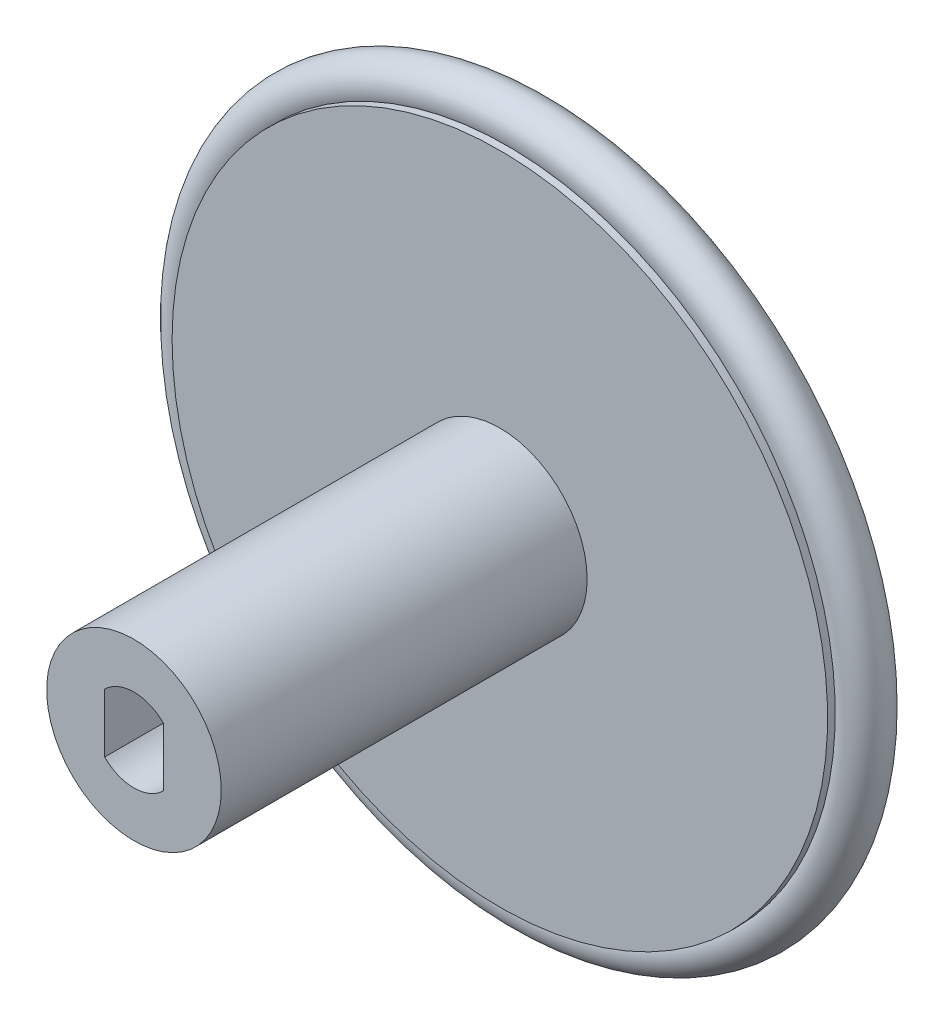
from build123d import *

# Parameters (mm, degrees)
CROQUIS3_R              = 5.725
SALIENTE_EXTRUIR2_DEPTH = 24
SALIENTE_EXTRUIR3_REACH = 48.199
SALIENTE_EXTRUIR3_START = -5
CROQUIS5_R              = 1.5


with BuildPart() as part:
    # Croquis1 → Revolución1 (revolve)
    with BuildSketch(Plane(origin=(0, 0, 0), x_dir=(0, 0, -1), z_dir=(1, 0, 0)), mode=Mode.PRIVATE) as revoluci_n1_sk:
        Polygon((-1.9, 0), (-1.9, 21.5), (-1.4, 21.5), (-0.5, 19.000153831), (0.5, 19.000153831), (1.4, 21.5), (1.9, 21.5), (1.9, 0), align=None)
    revolve(revoluci_n1_sk.sketch.rotate(Axis((0, 0, -6.227056579), (0, 0, 1)), 90), axis=Axis((0, 0, -6.227056579), (0, 0, 1)))

    # Croquis3 → Saliente-Extruir2 (add)
    with BuildSketch(Plane.XY.offset(1.9)):
        Circle(CROQUIS3_R)
        with BuildLine():
            Line((-1.925, 1.928730152), (-1.925, -1.928730152))
            ThreePointArc((-1.925, -1.928730152), (0, -2.725), (1.925, -1.928730152))
            Line((1.925, -1.928730152), (1.925, 1.928730152))
            ThreePointArc((1.925, 1.928730152), (0, 2.725), (-1.925, 1.928730152))
        make_face(mode=Mode.SUBTRACT)
    extrude(amount=SALIENTE_EXTRUIR2_DEPTH)

    # Croquis4 → Saliente-Extruir3 (add, up to next)
    with BuildSketch(Plane.XY.offset(25.9).offset(SALIENTE_EXTRUIR3_START), mode=Mode.PRIVATE) as saliente_extruir3_sk1:
        with BuildLine():
            Line((-1.925, 1.928730152), (-1.925, -1.928730152))
            ThreePointArc((-1.925, -1.928730152), (0, -2.725), (1.925, -1.928730152))
            Line((1.925, -1.928730152), (1.925, 1.928730152))
            ThreePointArc((1.925, 1.928730152), (0, 2.725), (-1.925, 1.928730152))
        make_face()
    saliente_extruir3_tool1 = extrude(saliente_extruir3_sk1.sketch, amount=-SALIENTE_EXTRUIR3_REACH, mode=Mode.PRIVATE) - part.part
    add(saliente_extruir3_tool1.solids().sort_by_distance((0, 0, 20.9))[0])


with BuildPart() as body_2:
    # Croquis5 → Revolución2 (revolve)
    with BuildSketch(Plane(origin=(0, 0, 0), x_dir=(0, 0, -1), z_dir=(1, 0, 0)), mode=Mode.PRIVATE) as revoluci_n2_sk:
        with Locations((0, 22.039552594)):
            Circle(CROQUIS5_R)
    revolve(revoluci_n2_sk.sketch.rotate(Axis((0, 0, 9.093206655), (0, 0, -1)), 90), axis=Axis((0, 0, 9.093206655), (0, 0, -1)))


solid = Compound([part.part, body_2.part])
